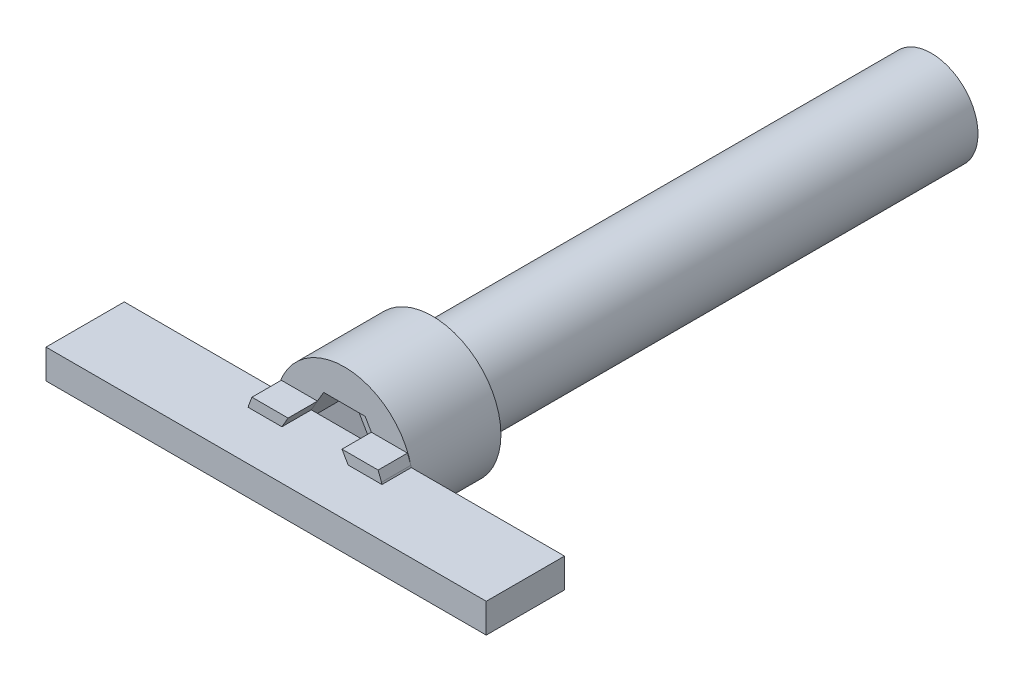
from build123d import *

# Parameters (mm, degrees)
ESBO_O1_R                  = 7
RESSALTO_EXTRUS_O1_DEPTH   = 9
ESBO_O2_R                  = 4.765
RESSALTO_EXTRUS_O2_DEPTH   = 51
CORTE_EXTRUS_O1_DEPTH      = 5
ESBO_O4_W                  = 45
ESBO_O4_H                  = 3
RESSALTO_EXTRUS_O3_DEPTH   = 8
RESSALTO_EXTRUS_O4_DEPTH   = 3
RESSALTO_EXTRUS_O4_2_DEPTH = 3
RESSALTO_EXTRUS_O5_DEPTH   = 3
RESSALTO_EXTRUS_O5_2_DEPTH = 3


with BuildPart() as part:
    # Esboço1 → Ressalto-extrusão1 (new body)
    with BuildSketch(Plane.XY):
        Circle(ESBO_O1_R)
    extrude(amount=RESSALTO_EXTRUS_O1_DEPTH)

    # Esboço2 → Ressalto-extrusão2 (add)
    with BuildSketch(Plane(origin=(0, 0, 0), x_dir=(-1, 0, 0), z_dir=(0, 0, -1))):
        with Locations(Location((0, 0, 0), (0, 0, 180))):
            Circle(ESBO_O2_R)
    extrude(amount=RESSALTO_EXTRUS_O2_DEPTH)

    # Esboço3 → Corte-extrusão1 (cut)
    with BuildSketch(Plane.XY.offset(9)):
        Polygon((4.25, 0), (2.125, 3.680607966), (-2.125, 3.680607966), (-4.25, 0), (-2.125, -3.680607966), (2.125, -3.680607966), align=None)
    extrude(amount=-CORTE_EXTRUS_O1_DEPTH, mode=Mode.SUBTRACT)

    # Esboço4 → Ressalto-extrusão3 (add)
    with BuildSketch(Plane.XY.offset(9)):
        Rectangle(ESBO_O4_W, ESBO_O4_H)
    extrude(amount=RESSALTO_EXTRUS_O3_DEPTH)


with BuildPart() as body_2:
    # Esboço5 → Ressalto-extrusão4 (new body)
    with BuildSketch(Plane.XY.offset(9)):
        Polygon((-6.837397166, -1.5), (-3.383974596, -1.5), (-2.754487298, -2.590303983), (-6.450319069, -2.590303983), (-6.796980481, -1.673635664), align=None)
    extrude(amount=RESSALTO_EXTRUS_O4_DEPTH)


with BuildPart() as body_3:
    # Esboço5 → Ressalto-extrus_o4 2 (new body)
    with BuildSketch(Plane.XY.offset(9)):
        Polygon((2.754487298, -2.590303983), (3.383974596, -1.5), (6.837397166, -1.5), (6.796980481, -1.673635664), (6.441898355, -2.590303983), align=None)
    extrude(amount=RESSALTO_EXTRUS_O4_2_DEPTH)


with BuildPart() as body_4:
    # Esboço7 → Ressalto-extrusão5 (new body)
    with BuildSketch(Plane.XY.offset(9)):
        Polygon((6.837397166, 1.5), (3.383974596, 1.5), (2.754487298, 2.590303983), (6.449322248, 2.590303983), (6.795083403, 1.681321368), align=None)
    extrude(amount=RESSALTO_EXTRUS_O5_DEPTH)


with BuildPart() as body_5:
    # Esboço7 → Ressalto-extrus_o5 2 (new body)
    with BuildSketch(Plane.XY.offset(9)):
        Polygon((-6.837397166, 1.5), (-3.383974596, 1.5), (-2.754487298, 2.590303983), (-6.44720819, 2.590303983), (-6.795083403, 1.681321368), align=None)
    extrude(amount=RESSALTO_EXTRUS_O5_2_DEPTH)


solid = Compound([part.part, body_2.part, body_3.part, body_4.part, body_5.part])
